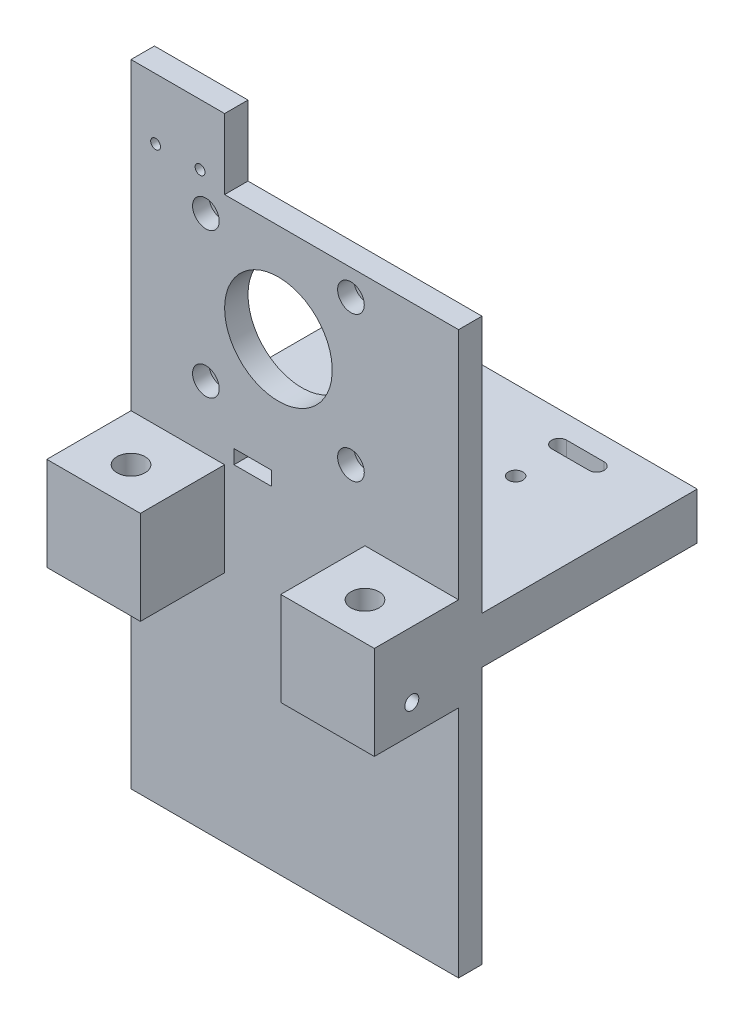
from build123d import *

# Parameters (mm, degrees)
SKETCH1_W           = 70
SKETCH1_H           = 120
BOSS_EXTRUDE1_DEPTH = 5
SKETCH2_W           = 20
SKETCH2_H           = 20
BOSS_EXTRUDE2_DEPTH = 18
CUT_EXTRUDE1_REACH  = 83.572
SKETCH3_R           = 3
CUT_EXTRUDE2_REACH  = 75.171
SKETCH4_R           = 11.5
SKETCH4_R_2         = 1.55
SKETCH5_W           = 20
SKETCH5_H           = 15
SKETCH5_R           = 1.05
BOSS_EXTRUDE3_DEPTH = 5
SKETCH6_W           = 70
SKETCH6_H           = 10
BOSS_EXTRUDE4_DEPTH = 46
SKETCH7_W           = 2.6
SKETCH7_H           = 5.7
CUT_EXTRUDE3_DEPTH  = 10
SKETCH8_R           = 1.5
CUT_EXTRUDE4_DEPTH  = 8
CUT_EXTRUDE5_START  = -8
SKETCH9_R           = 1.5
CUT_EXTRUDE5_DEPTH  = 8
SKETCH10_R          = 2.85
CUT_EXTRUDE6_DEPTH  = 3.5
CUT_EXTRUDE7_REACH  = 92.78
SKETCH11_R          = 1.55
CUT_EXTRUDE8_REACH  = 92.78
SKETCH14_W          = 8
SKETCH14_H          = 16
BOSS_EXTRUDE5_DEPTH = 4
CUT_EXTRUDE9_REACH  = 96.689
SKETCH15_W          = 8
SKETCH15_H          = 3


with BuildPart() as part:
    # Sketch1 → Boss-Extrude1 (new body)
    with BuildSketch(Plane.XY):
        Rectangle(SKETCH1_W, SKETCH1_H)
    extrude(amount=BOSS_EXTRUDE1_DEPTH)

    # Sketch2 → Boss-Extrude2 (add)
    with BuildSketch(Plane.XY.offset(5)):
        with Locations((-25, 0)):
            Rectangle(SKETCH2_W, SKETCH2_H)
        with Locations((25, 0)):
            Rectangle(SKETCH2_W, SKETCH2_H)
    extrude(amount=BOSS_EXTRUDE2_DEPTH)

    # Sketch3 → Cut-Extrude1 (cut, up to next)
    with BuildSketch(Plane(origin=(0, 10, 0), x_dir=(1, 0, 0), z_dir=(0, 1, 0)), mode=Mode.PRIVATE) as cut_extrude1_sk1:
        with Locations(Location((-25, -15, 0), (0, 0, 270))):
            Circle(SKETCH3_R)
    cut_extrude1_tool1 = extrude(cut_extrude1_sk1.sketch, amount=-CUT_EXTRUDE1_REACH, mode=Mode.PRIVATE) & part.part
    # Sketch3 → Cut-Extrude1 (cut, up to next)
    with BuildSketch(Plane(origin=(0, 10, 0), x_dir=(1, 0, 0), z_dir=(0, 1, 0)), mode=Mode.PRIVATE) as cut_extrude1_sk2:
        with Locations(Location((25, -15, 0), (0, 0, 270))):
            Circle(SKETCH3_R)
    cut_extrude1_tool2 = extrude(cut_extrude1_sk2.sketch, amount=-CUT_EXTRUDE1_REACH, mode=Mode.PRIVATE) & part.part
    add(cut_extrude1_tool1.solids().sort_by_distance((-25, 10, 15))[0], mode=Mode.SUBTRACT)
    add(cut_extrude1_tool2.solids().sort_by_distance((25, 10, 15))[0], mode=Mode.SUBTRACT)

    # Sketch4 → Cut-Extrude2 (cut, up to next)
    with BuildSketch(Plane(origin=(0, 0, 0), x_dir=(-1, 0, 0), z_dir=(0, 0, -1)), mode=Mode.PRIVATE) as cut_extrude2_sk1:
        with Locations((3.5, 39)):
            Circle(SKETCH4_R)
    cut_extrude2_tool1 = extrude(cut_extrude2_sk1.sketch, amount=-CUT_EXTRUDE2_REACH, mode=Mode.PRIVATE) & part.part
    # Sketch4 → Cut-Extrude2 (cut, up to next)
    with BuildSketch(Plane(origin=(0, 0, 0), x_dir=(-1, 0, 0), z_dir=(0, 0, -1)), mode=Mode.PRIVATE) as cut_extrude2_sk2:
        with Locations((-12, 54.5)):
            Circle(SKETCH4_R_2)
    cut_extrude2_tool2 = extrude(cut_extrude2_sk2.sketch, amount=-CUT_EXTRUDE2_REACH, mode=Mode.PRIVATE) & part.part
    # Sketch4 → Cut-Extrude2 (cut, up to next)
    with BuildSketch(Plane(origin=(0, 0, 0), x_dir=(-1, 0, 0), z_dir=(0, 0, -1)), mode=Mode.PRIVATE) as cut_extrude2_sk3:
        with Locations((19, 54.5)):
            Circle(SKETCH4_R_2)
    cut_extrude2_tool3 = extrude(cut_extrude2_sk3.sketch, amount=-CUT_EXTRUDE2_REACH, mode=Mode.PRIVATE) & part.part
    # Sketch4 → Cut-Extrude2 (cut, up to next)
    with BuildSketch(Plane(origin=(0, 0, 0), x_dir=(-1, 0, 0), z_dir=(0, 0, -1)), mode=Mode.PRIVATE) as cut_extrude2_sk4:
        with Locations((19, 23.5)):
            Circle(SKETCH4_R_2)
    cut_extrude2_tool4 = extrude(cut_extrude2_sk4.sketch, amount=-CUT_EXTRUDE2_REACH, mode=Mode.PRIVATE) & part.part
    # Sketch4 → Cut-Extrude2 (cut, up to next)
    with BuildSketch(Plane(origin=(0, 0, 0), x_dir=(-1, 0, 0), z_dir=(0, 0, -1)), mode=Mode.PRIVATE) as cut_extrude2_sk5:
        with Locations((-12, 23.5)):
            Circle(SKETCH4_R_2)
    cut_extrude2_tool5 = extrude(cut_extrude2_sk5.sketch, amount=-CUT_EXTRUDE2_REACH, mode=Mode.PRIVATE) & part.part
    add(cut_extrude2_tool1.solids().sort_by_distance((-3.5, 39, 0))[0], mode=Mode.SUBTRACT)
    add(cut_extrude2_tool2.solids().sort_by_distance((12, 54.5, 0))[0], mode=Mode.SUBTRACT)
    add(cut_extrude2_tool3.solids().sort_by_distance((-19, 54.5, 0))[0], mode=Mode.SUBTRACT)
    add(cut_extrude2_tool4.solids().sort_by_distance((-19, 23.5, 0))[0], mode=Mode.SUBTRACT)
    add(cut_extrude2_tool5.solids().sort_by_distance((12, 23.5, 0))[0], mode=Mode.SUBTRACT)

    # Sketch5 → Boss-Extrude3 (add)
    with BuildSketch(Plane(origin=(0, 0, 0), x_dir=(-1, 0, 0), z_dir=(0, 0, -1))):
        with Locations((25, 67.5)):
            Rectangle(SKETCH5_W, SKETCH5_H)
        with Locations((20.25, 62)):
            Circle(SKETCH5_R, mode=Mode.SUBTRACT)
        with Locations((29.75, 62)):
            Circle(SKETCH5_R, mode=Mode.SUBTRACT)
    extrude(amount=-BOSS_EXTRUDE3_DEPTH)

    # Sketch6 → Boss-Extrude4 (add)
    with BuildSketch(Plane(origin=(0, 0, 0), x_dir=(-1, 0, 0), z_dir=(0, 0, -1))):
        Rectangle(SKETCH6_W, SKETCH6_H)
    extrude(amount=BOSS_EXTRUDE4_DEPTH)

    # Sketch7 → Cut-Extrude3 (cut)
    with BuildSketch(Plane(origin=(0, -10, 0), x_dir=(1, 0, 0), z_dir=(0, 1, 0))):
        with Locations((30.7, -15)):
            Rectangle(SKETCH7_W, SKETCH7_H)
        with Locations((-30.7, -15)):
            Rectangle(SKETCH7_W, SKETCH7_H)
    extrude(amount=CUT_EXTRUDE3_DEPTH, mode=Mode.SUBTRACT)

    # Sketch8 → Cut-Extrude4 (cut)
    with BuildSketch(Plane(origin=(35, 0, 0), x_dir=(0, 0, -1), z_dir=(1, 0, 0))):
        with Locations((-15, -4)):
            Circle(SKETCH8_R)
    extrude(amount=-CUT_EXTRUDE4_DEPTH, mode=Mode.SUBTRACT)

    # Sketch9 → Cut-Extrude5 (cut)
    with BuildSketch(Plane.ZY.offset(35).offset(CUT_EXTRUDE5_START)):
        with Locations(Location((15, -4, 0), (0, 0, 180))):
            Circle(SKETCH9_R)
    extrude(amount=CUT_EXTRUDE5_DEPTH, mode=Mode.SUBTRACT)

    # Sketch10 → Cut-Extrude6 (cut)
    with BuildSketch(Plane.XY.offset(5)):
        with Locations((-19, 54.5)):
            Circle(SKETCH10_R)
        with Locations((12, 54.5)):
            Circle(SKETCH10_R)
        with Locations((12, 23.5)):
            Circle(SKETCH10_R)
        with Locations((-19, 23.5)):
            Circle(SKETCH10_R)
    extrude(amount=-CUT_EXTRUDE6_DEPTH, mode=Mode.SUBTRACT)

    # Sketch11 → Cut-Extrude7 (cut, up to next)
    with BuildSketch(Plane(origin=(0, 5, 0), x_dir=(1, 0, 0), z_dir=(0, 1, 0)), mode=Mode.PRIVATE) as cut_extrude7_sk1:
        with Locations(Location((-11.805993826, 29, 0), (0, 0, 270))):
            Circle(SKETCH11_R)
    cut_extrude7_tool1 = extrude(cut_extrude7_sk1.sketch, amount=-CUT_EXTRUDE7_REACH, mode=Mode.PRIVATE) & part.part
    # Sketch11 → Cut-Extrude7 (cut, up to next)
    with BuildSketch(Plane(origin=(0, 5, 0), x_dir=(1, 0, 0), z_dir=(0, 1, 0)), mode=Mode.PRIVATE) as cut_extrude7_sk2:
        with Locations(Location((-11.805993826, 4, 0), (0, 0, 270))):
            Circle(SKETCH11_R)
    cut_extrude7_tool2 = extrude(cut_extrude7_sk2.sketch, amount=-CUT_EXTRUDE7_REACH, mode=Mode.PRIVATE) & part.part
    # Sketch11 → Cut-Extrude7 (cut, up to next)
    with BuildSketch(Plane(origin=(0, 5, 0), x_dir=(1, 0, 0), z_dir=(0, 1, 0)), mode=Mode.PRIVATE) as cut_extrude7_sk3:
        with Locations(Location((13.194006174, 29, 0), (0, 0, 270))):
            Circle(SKETCH11_R)
    cut_extrude7_tool3 = extrude(cut_extrude7_sk3.sketch, amount=-CUT_EXTRUDE7_REACH, mode=Mode.PRIVATE) & part.part
    # Sketch11 → Cut-Extrude7 (cut, up to next)
    with BuildSketch(Plane(origin=(0, 5, 0), x_dir=(1, 0, 0), z_dir=(0, 1, 0)), mode=Mode.PRIVATE) as cut_extrude7_sk4:
        with Locations(Location((13.194006174, 4, 0), (0, 0, 270))):
            Circle(SKETCH11_R)
    cut_extrude7_tool4 = extrude(cut_extrude7_sk4.sketch, amount=-CUT_EXTRUDE7_REACH, mode=Mode.PRIVATE) & part.part
    add(cut_extrude7_tool1.solids().sort_by_distance((-11.805994, 5, -29))[0], mode=Mode.SUBTRACT)
    add(cut_extrude7_tool2.solids().sort_by_distance((-11.805994, 5, -4))[0], mode=Mode.SUBTRACT)
    add(cut_extrude7_tool3.solids().sort_by_distance((13.194006, 5, -29))[0], mode=Mode.SUBTRACT)
    add(cut_extrude7_tool4.solids().sort_by_distance((13.194006, 5, -4))[0], mode=Mode.SUBTRACT)

    # Sketch13 → Cut-Extrude8 (cut, up to next)
    with BuildSketch(Plane(origin=(0, 5, 0), x_dir=(1, 0, 0), z_dir=(0, 1, 0)), mode=Mode.PRIVATE) as cut_extrude8_sk1:
        with BuildLine():
            Line((-20, 41.1), (-12, 41.1))
            ThreePointArc((-12, 41.1), (-10.4, 39.5), (-12, 37.9))
            Line((-12, 37.9), (-20, 37.9))
            ThreePointArc((-20, 37.9), (-21.6, 39.5), (-20, 41.1))
        make_face()
    cut_extrude8_tool1 = extrude(cut_extrude8_sk1.sketch, amount=-CUT_EXTRUDE8_REACH, mode=Mode.PRIVATE) & part.part
    # Sketch13 → Cut-Extrude8 (cut, up to next)
    with BuildSketch(Plane(origin=(0, 5, 0), x_dir=(1, 0, 0), z_dir=(0, 1, 0)), mode=Mode.PRIVATE) as cut_extrude8_sk2:
        with BuildLine():
            Line((20, 41.1), (12, 41.1))
            ThreePointArc((12, 41.1), (10.4, 39.5), (12, 37.9))
            Line((12, 37.9), (20, 37.9))
            ThreePointArc((20, 37.9), (21.6, 39.5), (20, 41.1))
        make_face()
    cut_extrude8_tool2 = extrude(cut_extrude8_sk2.sketch, amount=-CUT_EXTRUDE8_REACH, mode=Mode.PRIVATE) & part.part
    add(cut_extrude8_tool1.solids().sort_by_distance((-16, 5, -39.5))[0], mode=Mode.SUBTRACT)
    add(cut_extrude8_tool2.solids().sort_by_distance((16, 5, -39.5))[0], mode=Mode.SUBTRACT)

    # Sketch14 → Boss-Extrude5 (add)
    with BuildSketch(Plane.ZY.offset(35)):
        with Locations((-4, -13)):
            Rectangle(SKETCH14_W, SKETCH14_H)
    extrude(amount=-BOSS_EXTRUDE5_DEPTH)

    # Sketch15 → Cut-Extrude9 (cut, up to next)
    with BuildSketch(Plane(origin=(0, 0, 0), x_dir=(-1, 0, 0), z_dir=(0, 0, -1)), mode=Mode.PRIVATE) as cut_extrude9_sk1:
        with Locations((9, 12.5)):
            Rectangle(SKETCH15_W, SKETCH15_H)
    cut_extrude9_tool1 = extrude(cut_extrude9_sk1.sketch, amount=-CUT_EXTRUDE9_REACH, mode=Mode.PRIVATE) & part.part
    add(cut_extrude9_tool1.solids().sort_by_distance((-9, 12.5, 0))[0], mode=Mode.SUBTRACT)


solid = part.part
